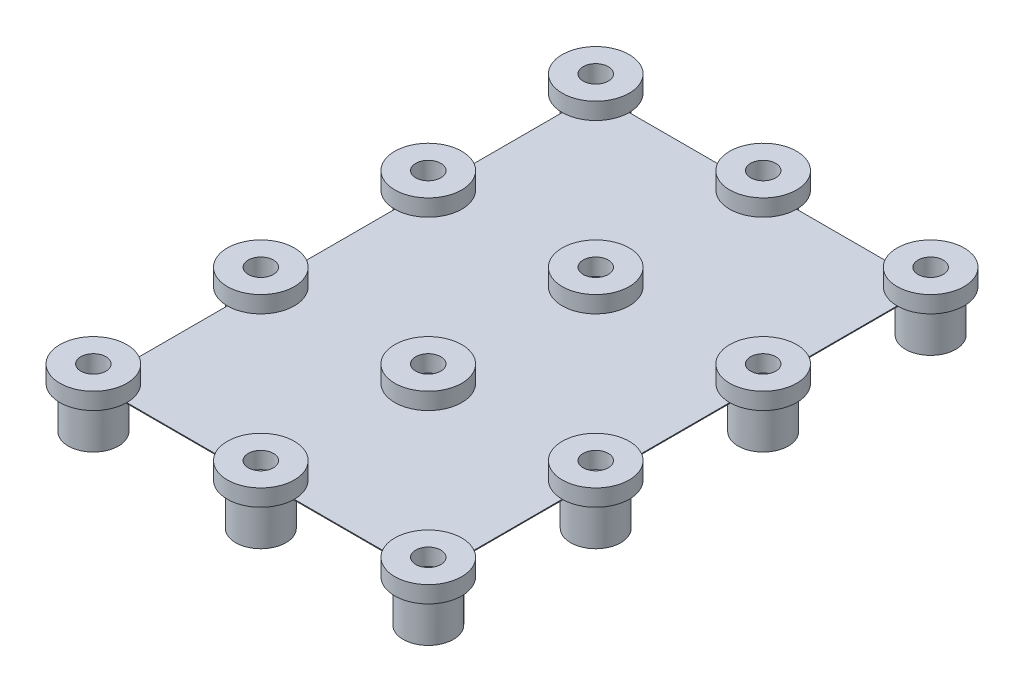
from build123d import *

# Parameters (mm, degrees)
SKETCH2_W            = 40
SKETCH2_H            = 60
BOSS_EXTRUDE1_DEPTH  = 0.1
SKETCH3_R            = 4
SKETCH3_R_2          = 1.5
BOSS_EXTRUDE2_DEPTH  = 2
BOSS_EXTRUDE5_START  = 5
SKETCH7_R            = 3
SKETCH7_R_2          = 1.5
BOSS_EXTRUDE5_DEPTH  = 5
LPATTERN1_COUNT      = 3
LPATTERN1_PITCH      = 20
LPATTERN1_COUNT_DIR2 = 4
LPATTERN1_PITCH_DIR2 = 20


with BuildPart() as part:
    # Sketch2 → Boss-Extrude1 (new body)
    with BuildSketch(Plane(origin=(0, 0, 0), x_dir=(1, 0, 0), z_dir=(0, 1, 0))):
        with Locations((20, 30)):
            Rectangle(SKETCH2_W, SKETCH2_H)
    extrude(amount=BOSS_EXTRUDE1_DEPTH)

    # Sketch3 → Boss-Extrude2 (add)
    with BuildSketch(Plane(origin=(0, 0.1, 0), x_dir=(1, 0, 0), z_dir=(0, 1, 0))):
        Circle(SKETCH3_R)
        Circle(SKETCH3_R_2, mode=Mode.SUBTRACT)
    boss_extrude2 = extrude(amount=BOSS_EXTRUDE2_DEPTH)

    # Sketch7 → Boss-Extrude5 (add)
    with BuildSketch(Plane.XZ.offset(-0.1).offset(BOSS_EXTRUDE5_START)):
        Circle(SKETCH7_R)
        Circle(SKETCH7_R_2, mode=Mode.SUBTRACT)
    boss_extrude5 = extrude(amount=-BOSS_EXTRUDE5_DEPTH)

    # LPattern1: Boss-Extrude2, Boss-Extrude5 3 × 4
    with Locations(*[(i * LPATTERN1_PITCH, 0, -j * LPATTERN1_PITCH_DIR2) for i in range(LPATTERN1_COUNT) for j in range(LPATTERN1_COUNT_DIR2) if (i, j) != (0, 0)]):
        add(boss_extrude2)
        add(boss_extrude5)


solid = part.part
